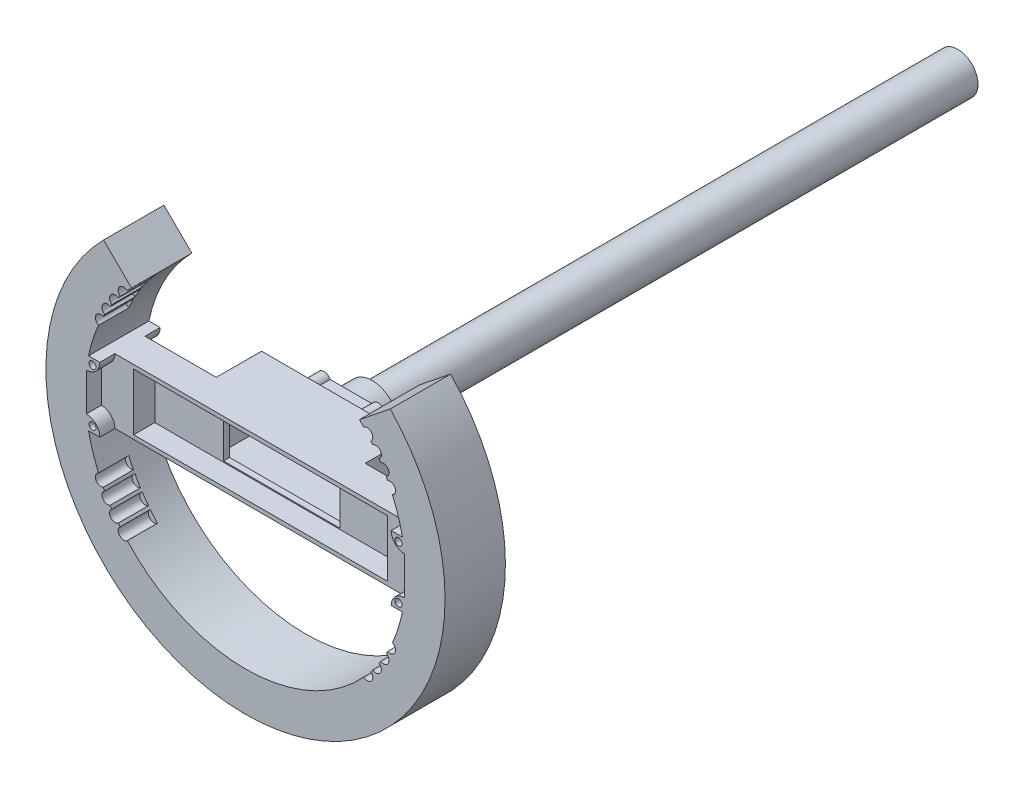
from build123d import *

# Parameters (mm, degrees)
BOSS_EXTRUDE1_DEPTH      = 10
BOSS_EXTRUDE2_DEPTH      = 15
BOSS_EXTRUDE2_DEPTH_BACK = 5
CUT_EXTRUDE1_START       = -10
CUT_EXTRUDE1_DEPTH       = 10
SKETCH6_W                = 42.060238999
SKETCH6_H                = 18.845288768
SKETCH6_W_2              = 42.060238998
CUT_EXTRUDE2_DEPTH       = 7
SKETCH7_W                = 19.300398124
SKETCH7_H                = 18.082590988
CUT_EXTRUDE3_DEPTH       = 3
CUT_EXTRUDE4_DEPTH       = 1
BOSS_EXTRUDE3_DEPTH      = 15
SKETCH10_W               = 46.377174408
SKETCH10_H               = 20.219056067
BOSS_EXTRUDE4_DEPTH      = 3
BOSS_EXTRUDE5_DEPTH      = 12
SKETCH12_R               = 0.858972398
BOSS_EXTRUDE6_DEPTH      = 5
BOSS_EXTRUDE7_START      = -15
SKETCH13_R               = 1.168011764
BOSS_EXTRUDE7_DEPTH      = 20
SKETCH14_R               = 6.714180922
BOSS_EXTRUDE8_DEPTH      = 206


with BuildPart() as part:
    # Sketch1 → Boss-Extrude1 (new body)
    with BuildSketch(Plane.XY):
        with BuildLine():
            Line((52.732433476, 10.749052425), (52.732433476, 21.49810485))
            Line((52.732433476, 21.49810485), (4.46438135, 21.49810485))
            ThreePointArc((4.46438135, 21.49810485), (3.156794326, 18.341310523), (0, 17.0337235))
            Line((0, 17.0337235), (0, 10.749052425))
            Line((0, 10.749052425), (52.732433476, 10.749052425))
        make_face()
        with BuildLine():
            Line((52.732433476, 0), (52.732433476, 10.749052425))
            Line((52.732433476, 10.749052425), (0, 10.749052425))
            Line((0, 10.749052425), (0, 4.46438135))
            ThreePointArc((0, 4.46438135), (3.156794326, 3.156794326), (4.46438135, 0))
            Line((4.46438135, 0), (52.732433476, 0))
        make_face()
        with BuildLine():
            Line((101.000485603, 21.49810485), (52.732433476, 21.49810485))
            Line((52.732433476, 21.49810485), (52.732433476, 10.749052425))
            Line((52.732433476, 10.749052425), (105.464866953, 10.749052425))
            Line((105.464866953, 10.749052425), (105.464866953, 17.0337235))
            ThreePointArc((105.464866953, 17.0337235), (102.308072626, 18.341310523), (101.000485603, 21.49810485))
        make_face()
        with BuildLine():
            Line((105.464866953, 10.749052425), (52.732433476, 10.749052425))
            Line((52.732433476, 10.749052425), (52.732433476, 0))
            Line((52.732433476, 0), (101.000485603, 0))
            ThreePointArc((101.000485603, 0), (102.308072626, 3.156794326), (105.464866953, 4.46438135))
            Line((105.464866953, 4.46438135), (105.464866953, 10.749052425))
        make_face()
    extrude(amount=BOSS_EXTRUDE1_DEPTH)

    # Sketch2 → Boss-Extrude2 (add, two sides: drawn at the far end of the back side and taken through both)
    with BuildSketch(Plane.XY.offset(-BOSS_EXTRUDE2_DEPTH_BACK)):
        with BuildLine():
            Line((0, 4.46438135), (0, 10.749052425))
            Line((0, 10.749052425), (0, 17.0337235))
            ThreePointArc((0, 17.0337235), (4.893658977, 33.806768818), (14.965790311, 48.083852477))
            Line((14.965790311, 48.083852477), (5.708850134, 57.234944066))
            ThreePointArc((5.708850134, 57.234944066), (27.604270889, -50.412462902), (118.854710449, 10.749052425))
            ThreePointArc((118.854710449, 10.749052425), (114.152703784, 35.237945978), (100.715410507, 56.243990905))
            Line((100.715410507, 56.243990905), (90.499076641, 48.083852477))
            ThreePointArc((90.499076641, 48.083852477), (100.571207976, 33.806768818), (105.464866953, 17.0337235))
            Line((105.464866953, 17.0337235), (105.464866953, 10.749052425))
            Line((105.464866953, 10.749052425), (105.464866953, 4.46438135))
            ThreePointArc((105.464866953, 4.46438135), (52.732433476, -42.356565271), (0, 4.46438135))
        make_face()
    extrude(amount=BOSS_EXTRUDE2_DEPTH + BOSS_EXTRUDE2_DEPTH_BACK)

    # Sketch5 → Cut-Extrude1 (cut)
    with BuildSketch(Plane.XY.offset(15).offset(CUT_EXTRUDE1_START)):
        with BuildLine():
            ThreePointArc((4.044258264, 31.954434414), (4.803406416, 33.618573536), (5.619413687, 35.25558211))
            ThreePointArc((5.619413687, 35.25558211), (3.181262127, 34.392585974), (4.044258264, 31.954434414))
        make_face()
        with BuildLine():
            ThreePointArc((6.077702287, 36.117195607), (6.979000933, 37.708838057), (7.934577748, 39.268497598))
            ThreePointArc((7.934577748, 39.268497598), (5.430489022, 38.621284333), (6.077702287, 36.117195607))
        make_face()
        with BuildLine():
            ThreePointArc((8.466216986, 40.086889913), (9.502806698, 41.59392233), (10.590680541, 43.064362889))
            ThreePointArc((10.590680541, 43.064362889), (8.039712275, 42.637858178), (8.466216986, 40.086889913))
        make_face()
        with BuildLine():
            ThreePointArc((11.191624321, 43.833305561), (12.355616026, 45.244258518), (13.567507519, 46.614289154))
            ThreePointArc((13.567507519, 46.614289154), (10.989074123, 46.411738956), (11.191624321, 43.833305561))
        make_face()
        with BuildLine():
            ThreePointArc((101.420608689, 31.954434414), (102.283604825, 34.392585974), (99.845453266, 35.25558211))
            ThreePointArc((99.845453266, 35.25558211), (100.661460537, 33.618573536), (101.420608689, 31.954434414))
        make_face()
        with BuildLine():
            ThreePointArc((99.387164666, 36.117195607), (100.034377931, 38.621284333), (97.530289205, 39.268497598))
            ThreePointArc((97.530289205, 39.268497598), (98.48586602, 37.708838057), (99.387164666, 36.117195607))
        make_face()
        with BuildLine():
            ThreePointArc((96.998649967, 40.086889913), (97.425154677, 42.637858178), (94.874186412, 43.064362889))
            ThreePointArc((94.874186412, 43.064362889), (95.962060255, 41.59392233), (96.998649967, 40.086889913))
        make_face()
        with BuildLine():
            ThreePointArc((94.273242632, 43.833305561), (94.475792829, 46.411738956), (91.897359434, 46.614289154))
            ThreePointArc((91.897359434, 46.614289154), (93.109250927, 45.244258518), (94.273242632, 43.833305561))
        make_face()
        with BuildLine():
            ThreePointArc((5.619413687, -13.75747726), (4.803406416, -12.120468687), (4.044258264, -10.456329564))
            ThreePointArc((4.044258264, -10.456329564), (3.181262127, -12.894481124), (5.619413687, -13.75747726))
        make_face()
        with BuildLine():
            ThreePointArc((7.934577748, -17.770392749), (6.979000933, -16.210733207), (6.077702287, -14.619090757))
            ThreePointArc((6.077702287, -14.619090757), (5.430489022, -17.123179483), (7.934577748, -17.770392749))
        make_face()
        with BuildLine():
            ThreePointArc((10.590680541, -21.566258039), (9.502806698, -20.09581748), (8.466216986, -18.588785063))
            ThreePointArc((8.466216986, -18.588785063), (8.039712275, -21.139753328), (10.590680541, -21.566258039))
        make_face()
        with BuildLine():
            ThreePointArc((13.567507519, -25.116184304), (12.355616026, -23.746153668), (11.191624321, -22.335200711))
            ThreePointArc((11.191624321, -22.335200711), (10.989074123, -24.913634107), (13.567507519, -25.116184304))
        make_face()
        with BuildLine():
            ThreePointArc((94.273242632, -22.335200711), (93.109250927, -23.746153668), (91.897359434, -25.116184304))
            ThreePointArc((91.897359434, -25.116184304), (94.475792829, -24.913634107), (94.273242632, -22.335200711))
        make_face()
        with BuildLine():
            ThreePointArc((94.874186412, -21.566258039), (97.425154677, -21.139753328), (96.998649967, -18.588785063))
            ThreePointArc((96.998649967, -18.588785063), (95.962060255, -20.09581748), (94.874186412, -21.566258039))
        make_face()
        with BuildLine():
            ThreePointArc((97.530289205, -17.770392749), (100.034377931, -17.123179483), (99.387164666, -14.619090757))
            ThreePointArc((99.387164666, -14.619090757), (98.48586602, -16.210733207), (97.530289205, -17.770392749))
        make_face()
        with BuildLine():
            ThreePointArc((99.845453266, -13.75747726), (102.283604825, -12.894481124), (101.420608689, -10.456329564))
            ThreePointArc((101.420608689, -10.456329564), (100.661460537, -12.120468687), (99.845453266, -13.75747726))
        make_face()
    extrude(amount=CUT_EXTRUDE1_DEPTH, mode=Mode.SUBTRACT)

    # Sketch6 → Cut-Extrude2 (cut)
    with BuildSketch(Plane.XY.offset(10)):
        with Locations((73.762552976, 10.749052425)):
            Rectangle(SKETCH6_W, SKETCH6_H)
        with Locations((31.702313977, 10.749052425)):
            Rectangle(SKETCH6_W_2, SKETCH6_H)
    extrude(amount=-CUT_EXTRUDE2_DEPTH, mode=Mode.SUBTRACT)

    # Sketch7 → Cut-Extrude3 (cut)
    with BuildSketch(Plane(origin=(0, 0, 0), x_dir=(-1, 0, 0), z_dir=(0, 0, -1))):
        with Locations((-62.382632538, 10.749052425)):
            Rectangle(SKETCH7_W, SKETCH7_H)
        with Locations((-43.082234414, 10.749052425)):
            Rectangle(SKETCH7_W, SKETCH7_H)
    extrude(amount=-CUT_EXTRUDE3_DEPTH, mode=Mode.SUBTRACT)

    # Sketch8 → Cut-Extrude4 (cut)
    with BuildSketch(Plane(origin=(0, 0, 0), x_dir=(-1, 0, 0), z_dir=(0, 0, -1))):
        Polygon((-52.732433476, 19.790347919), (-52.732433476, 20.858580458), (-74.546819617, 20.858580458), (-74.546819617, 0.639524391), (-52.732433476, 0.639524391), (-52.732433476, 1.707756931), (-72.0328316, 1.707756931), (-72.0328316, 19.790347919), align=None)
        Polygon((-30.918047336, 20.858580458), (-52.732433476, 20.858580458), (-52.732433476, 19.790347919), (-33.432035352, 19.790347919), (-33.432035352, 1.707756931), (-52.732433476, 1.707756931), (-52.732433476, 0.639524391), (-30.918047336, 0.639524391), align=None)
    extrude(amount=-CUT_EXTRUDE4_DEPTH, mode=Mode.SUBTRACT)

    # Sketch9 → Boss-Extrude3 (add)
    with BuildSketch(Plane(origin=(0, 0, 0), x_dir=(-1, 0, 0), z_dir=(0, 0, -1))):
        Polygon((-52.742982521, 20.858580458), (-52.743305955, 21.49810485), (-75.92645692, 21.49810485), (-75.92645692, 20.858580458), (-74.546819617, 20.858580458), align=None)
        Polygon((-29.549282512, 21.49810485), (-52.743305955, 21.49810485), (-52.742982521, 20.858580458), (-30.918047336, 20.858580458), (-29.549282512, 20.858580458), align=None)
        Polygon((-75.92645692, 20.858580458), (-75.92645692, 21.49810485), (-77.410535202, 21.49810485), (-77.410535202, 0), (-75.92645692, 0), (-75.92645692, 0.639524391), align=None)
        Polygon((-52.732433476, 0), (-52.73275691, 0.639524391), (-74.546819617, 0.639524391), (-75.92645692, 0.639524391), (-75.92645692, 0), align=None)
        Polygon((-30.918047336, 0.639524391), (-52.73275691, 0.639524391), (-52.732433476, 0), (-29.549282512, 0), (-29.549282512, 0.639524391), align=None)
        Polygon((-28.065204229, 21.49810485), (-29.549282512, 21.49810485), (-29.549282512, 20.858580458), (-29.549282512, 0.639524391), (-29.549282512, 0), (-28.065204229, 0), align=None)
    extrude(amount=BOSS_EXTRUDE3_DEPTH)

    # Sketch10 → Boss-Extrude4 (add)
    with BuildSketch(Plane(origin=(0, 0, -15), x_dir=(-1, 0, 0), z_dir=(0, 0, -1))):
        with Locations((-52.737869716, 10.749052425)):
            Rectangle(SKETCH10_W, SKETCH10_H)
    extrude(amount=-BOSS_EXTRUDE4_DEPTH)

    # Sketch11 → Boss-Extrude5 (add)
    with BuildSketch(Plane(origin=(0, 0, -15), x_dir=(-1, 0, 0), z_dir=(0, 0, -1))):
        with BuildLine():
            ThreePointArc((-44.070109377, 10.749052425), (-46.608837602, 16.878084538), (-52.737869716, 19.416812764))
            Line((-52.737869716, 19.416812764), (-52.737869716, 17.416812764))
            ThreePointArc((-52.737869716, 17.416812764), (-48.023051165, 15.463870976), (-46.070109377, 10.749052425))
            ThreePointArc((-46.070109377, 10.749052425), (-48.023051165, 6.034233874), (-52.737869716, 4.081292086))
            Line((-52.737869716, 4.081292086), (-52.737869716, 2.081292086))
            ThreePointArc((-52.737869716, 2.081292086), (-46.608837602, 4.620020311), (-44.070109377, 10.749052425))
        make_face()
        with BuildLine():
            Line((-52.737869716, 17.416812764), (-52.737869716, 19.416812764))
            ThreePointArc((-52.737869716, 19.416812764), (-61.405630055, 10.749052425), (-52.737869716, 2.081292086))
            Line((-52.737869716, 2.081292086), (-52.737869716, 4.081292086))
            ThreePointArc((-52.737869716, 4.081292086), (-59.405630055, 10.749052425), (-52.737869716, 17.416812764))
        make_face()
    extrude(amount=BOSS_EXTRUDE5_DEPTH)

    # Sketch12 → Boss-Extrude6 (add)
    # profile 1 of 7: a face of its own
    with BuildSketch(Plane(origin=(0, 0, -15), x_dir=(-1, 0, 0), z_dir=(0, 0, -1))):
        with BuildLine():
            Line((-62.737869716, 19.749052425), (-59.712785902, 19.749052425))
            ThreePointArc((-59.712785902, 19.749052425), (-63.219447031, 20.415356607), (-62.737869716, 16.87859017))
            Line((-62.737869716, 16.87859017), (-62.737869716, 19.749052425))
        make_face()
    # profile 2 of 7: a face of its own
    with BuildSketch(Plane(origin=(0, 0, -15), x_dir=(-1, 0, 0), z_dir=(0, 0, -1))):
        with BuildLine():
            Line((-52.737869716, 19.416812764), (-52.737869716, 19.749052425))
            Line((-52.737869716, 19.749052425), (-59.712785902, 19.749052425))
            Line((-59.712785902, 19.749052425), (-62.737869716, 19.749052425))
            Line((-62.737869716, 19.749052425), (-62.737869716, 16.87859017))
            Line((-62.737869716, 16.87859017), (-62.737869716, 10.749052425))
            Line((-62.737869716, 10.749052425), (-61.405630055, 10.749052425))
            ThreePointArc((-61.405630055, 10.749052425), (-58.866901829, 16.878084538), (-52.737869716, 19.416812764))
        make_face()
        with Locations((-61.705896639, 18.820276656)):
            Circle(SKETCH12_R, mode=Mode.SUBTRACT)
    # profile 3 of 7: a face of its own
    with BuildSketch(Plane(origin=(0, 0, -15), x_dir=(-1, 0, 0), z_dir=(0, 0, -1))):
        with BuildLine():
            Line((-45.76295353, 19.749052425), (-52.737869716, 19.749052425))
            Line((-52.737869716, 19.749052425), (-52.737869716, 19.416812764))
            ThreePointArc((-52.737869716, 19.416812764), (-46.608837602, 16.878084538), (-44.070109377, 10.749052425))
            Line((-44.070109377, 10.749052425), (-42.737869716, 10.749052425))
            Line((-42.737869716, 10.749052425), (-42.737869716, 16.87859017))
            ThreePointArc((-42.737869716, 16.87859017), (-42.256292401, 20.415356607), (-45.76295353, 19.749052425))
        make_face()
        with Locations((-43.769842793, 18.820276656)):
            Circle(SKETCH12_R, mode=Mode.SUBTRACT)
    # profile 4 of 7: a face of its own
    with BuildSketch(Plane(origin=(0, 0, -15), x_dir=(-1, 0, 0), z_dir=(0, 0, -1))):
        with BuildLine():
            Line((-42.737869716, 10.749052425), (-44.070109377, 10.749052425))
            ThreePointArc((-44.070109377, 10.749052425), (-46.608837602, 4.620020311), (-52.737869716, 2.081292086))
            Line((-52.737869716, 2.081292086), (-52.737869716, 1.749052425))
            Line((-52.737869716, 1.749052425), (-45.76295353, 1.749052425))
            Line((-45.76295353, 1.749052425), (-42.737869716, 1.749052425))
            Line((-42.737869716, 1.749052425), (-42.737869716, 4.61951468))
            Line((-42.737869716, 4.61951468), (-42.737869716, 10.749052425))
        make_face()
        with Locations((-43.769842793, 2.677828194)):
            Circle(SKETCH12_R, mode=Mode.SUBTRACT)
    # profile 5 of 7: a face of its own
    with BuildSketch(Plane(origin=(0, 0, -15), x_dir=(-1, 0, 0), z_dir=(0, 0, -1))):
        with BuildLine():
            ThreePointArc((-45.76295353, 1.749052425), (-42.256292401, 1.082748243), (-42.737869716, 4.61951468))
            Line((-42.737869716, 4.61951468), (-42.737869716, 1.749052425))
            Line((-42.737869716, 1.749052425), (-45.76295353, 1.749052425))
        make_face()
    # profile 6 of 7: a face of its own
    with BuildSketch(Plane(origin=(0, 0, -15), x_dir=(-1, 0, 0), z_dir=(0, 0, -1))):
        with BuildLine():
            ThreePointArc((-52.737869716, 2.081292086), (-58.866901829, 4.620020311), (-61.405630055, 10.749052425))
            Line((-61.405630055, 10.749052425), (-62.737869716, 10.749052425))
            Line((-62.737869716, 10.749052425), (-62.737869716, 4.61951468))
            Line((-62.737869716, 4.61951468), (-62.737869716, 1.749052425))
            Line((-62.737869716, 1.749052425), (-59.712785902, 1.749052425))
            Line((-59.712785902, 1.749052425), (-52.737869716, 1.749052425))
            Line((-52.737869716, 1.749052425), (-52.737869716, 2.081292086))
        make_face()
        with Locations((-61.705896639, 2.677828194)):
            Circle(SKETCH12_R, mode=Mode.SUBTRACT)
    # profile 7 of 7: a face of its own
    with BuildSketch(Plane(origin=(0, 0, -15), x_dir=(-1, 0, 0), z_dir=(0, 0, -1))):
        with BuildLine():
            Line((-62.737869716, 1.749052425), (-62.737869716, 4.61951468))
            ThreePointArc((-62.737869716, 4.61951468), (-63.219447031, 1.082748243), (-59.712785902, 1.749052425))
            Line((-59.712785902, 1.749052425), (-62.737869716, 1.749052425))
        make_face()
    extrude(amount=BOSS_EXTRUDE6_DEPTH)

    # Sketch13 → Boss-Extrude7 (add)
    # profile 1 of 4: a face of its own
    with BuildSketch(Plane.XY.offset(10).offset(BOSS_EXTRUDE7_START)):
        with BuildLine():
            ThreePointArc((0, 17.0337235), (3.156794326, 18.341310523), (4.46438135, 21.49810485))
            Line((4.46438135, 21.49810485), (0.726044419, 21.49810485))
            ThreePointArc((0.726044419, 21.49810485), (0.315471416, 19.273647382), (0, 17.0337235))
        make_face()
        with Locations((2.047326048, 19.502285627)):
            Circle(SKETCH13_R, mode=Mode.SUBTRACT)
    # profile 2 of 4: a face of its own
    with BuildSketch(Plane.XY.offset(10).offset(BOSS_EXTRUDE7_START)):
        with BuildLine():
            Line((0.726044419, 0), (4.46438135, 0))
            ThreePointArc((4.46438135, 0), (3.156794326, 3.156794326), (0, 4.46438135))
            ThreePointArc((0, 4.46438135), (0.315471416, 2.224457467), (0.726044419, 0))
        make_face()
        with Locations((2.047326048, 1.995819223)):
            Circle(SKETCH13_R, mode=Mode.SUBTRACT)
    # profile 3 of 4: a face of its own
    with BuildSketch(Plane.XY.offset(10).offset(BOSS_EXTRUDE7_START)):
        with BuildLine():
            Line((104.738822534, 21.49810485), (101.000485603, 21.49810485))
            ThreePointArc((101.000485603, 21.49810485), (102.308072626, 18.341310523), (105.464866953, 17.0337235))
            ThreePointArc((105.464866953, 17.0337235), (105.149395537, 19.273647382), (104.738822534, 21.49810485))
        make_face()
        with Locations((103.417540905, 19.502285627)):
            Circle(SKETCH13_R, mode=Mode.SUBTRACT)
    # profile 4 of 4: a face of its own
    with BuildSketch(Plane.XY.offset(10).offset(BOSS_EXTRUDE7_START)):
        with BuildLine():
            ThreePointArc((105.464866953, 4.46438135), (102.308072626, 3.156794326), (101.000485603, 0))
            Line((101.000485603, 0), (104.738822534, 0))
            ThreePointArc((104.738822534, 0), (105.149395537, 2.224457467), (105.464866953, 4.46438135))
        make_face()
        with Locations((103.417540905, 1.995819223)):
            Circle(SKETCH13_R, mode=Mode.SUBTRACT)
    extrude(amount=BOSS_EXTRUDE7_DEPTH)

    # Sketch14 → Boss-Extrude8 (add)
    with BuildSketch(Plane(origin=(0, 0, -15), x_dir=(-1, 0, 0), z_dir=(0, 0, -1))):
        with Locations((-52.737869716, 10.749052425)):
            Circle(SKETCH14_R)
    extrude(amount=BOSS_EXTRUDE8_DEPTH)


solid = part.part
